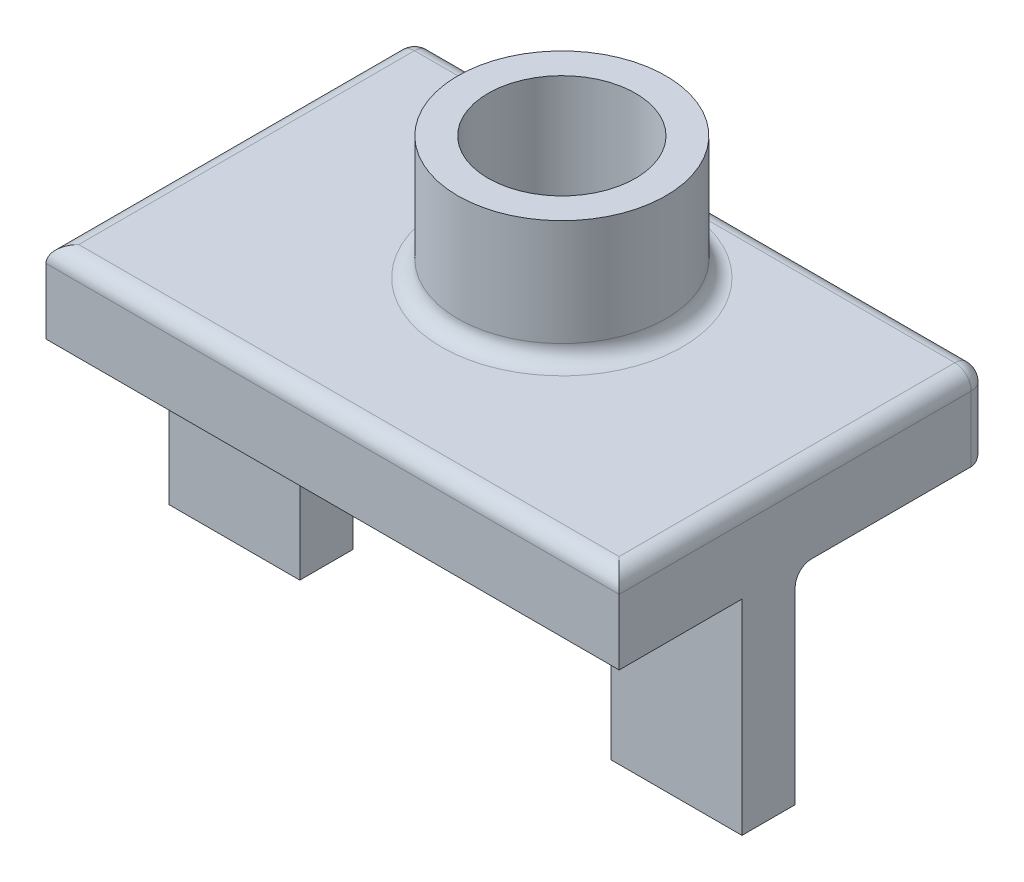
from build123d import *

# Parameters (mm, degrees)
SKETCH1_W           = 70
SKETCH1_H           = 45
BOSS_EXTRUDE1_DEPTH = 10
CUT_EXTRUDE1_DEPTH  = 5
FILLET1_R           = 2
SKETCH3_R           = 9
CUT_EXTRUDE3_DEPTH  = 25
BOSS_EXTRUDE2_START = 15
SKETCH5_R           = 12.7
SKETCH5_R_2         = 9
BOSS_EXTRUDE2_DEPTH = 15
FILLET2_R           = 2
SKETCH6_R           = 12.7
BOSS_EXTRUDE3_DEPTH = 8
FILLET3_R           = 2
SKETCH7_R           = 9
CUT_EXTRUDE4_DEPTH  = 5
SKETCH8_W           = 16
SKETCH8_H           = 6.5
BOSS_EXTRUDE4_DEPTH = 25
FILLET4_R           = 2


with BuildPart() as part:
    # Sketch1 → Boss-Extrude1 (new body)
    with BuildSketch(Plane(origin=(0, 0, 0), x_dir=(1, 0, 0), z_dir=(0, 1, 0))):
        with Locations((-1.479524439, -4.65323646)):
            Rectangle(SKETCH1_W, SKETCH1_H)
    extrude(amount=BOSS_EXTRUDE1_DEPTH)

    # Sketch2 → Cut-Extrude1 (cut)
    with BuildSketch(Plane.XZ):
        Polygon((28.520475561, 24.15323646), (17.520475561, 24.15323646), (17.520475561, 12.15323646), (28.520475561, 12.15323646), (28.520475561, 21.15323646), (32.520475561, 21.15323646), (32.520475561, 24.15323646), align=None)
        Polygon((-31.479524439, 21.15323646), (-35.479524439, 21.15323646), (-35.479524439, 24.15323646), (-31.479524439, 24.15323646), (-20.479524439, 24.15323646), (-20.479524439, 12.15323646), (-31.479524439, 12.15323646), align=None)
    extrude(amount=-CUT_EXTRUDE1_DEPTH, mode=Mode.SUBTRACT)

    # Fillet1
    fillet1_edges = [part.edges().sort_by_distance(p)[0] for p in [
        (33.520475561, 10, 4.65323646),
        (-1.479524439, 10, -17.84676354),
        (-36.479524439, 10, 4.65323646),
        (-1.479524439, 0, -17.84676354),
        (-36.479524439, 5, -17.84676354),
        (33.520475561, 5, -17.84676354),
        (-1.479524439, 10, 27.15323646),
    ]]
    fillet(fillet1_edges, radius=FILLET1_R)

    # Sketch3 → Cut-Extrude3 (cut)
    with BuildSketch(Plane(origin=(0, 10, 0), x_dir=(1, 0, 0), z_dir=(0, 1, 0))):
        with Locations(Location((-1.479524439, 0.84676354, 0), (0, 0, 270))):
            Circle(SKETCH3_R)
    extrude(amount=-CUT_EXTRUDE3_DEPTH, mode=Mode.SUBTRACT)

    # Sketch5 → Boss-Extrude2 (add)
    with BuildSketch(Plane(origin=(0, 10, 0), x_dir=(1, 0, 0), z_dir=(0, 1, 0)).offset(BOSS_EXTRUDE2_START)):
        with Locations(Location((-1.479524439, 0.84676354, 0), (0, 0, 270))):
            Circle(SKETCH5_R)
        with Locations(Location((-1.479524439, 0.84676354, 0), (0, 0, 270))):
            Circle(SKETCH5_R_2, mode=Mode.SUBTRACT)
    extrude(amount=-BOSS_EXTRUDE2_DEPTH)

    # Fillet2
    fillet2_edges = [part.edges().sort_by_distance(p)[0] for p in [
        (-1.479524439, 10, -13.54676354),
    ]]
    fillet(fillet2_edges, radius=FILLET2_R)

    # Sketch6 → Boss-Extrude3 (add)
    with BuildSketch(Plane.XZ):
        with Locations(Location((-1.479524439, -0.84676354, 0), (0, 0, 90))):
            Circle(SKETCH6_R)
    extrude(amount=BOSS_EXTRUDE3_DEPTH)

    # Fillet3
    fillet3_edges = [part.edges().sort_by_distance(p)[0] for p in [
        (-1.479524439, 0, -13.54676354),
    ]]
    fillet(fillet3_edges, radius=FILLET3_R)

    # Sketch7 → Cut-Extrude4 (cut)
    with BuildSketch(Plane(origin=(0, 0, 0), x_dir=(1, 0, 0), z_dir=(0, 1, 0))):
        with Locations(Location((-1.479524439, 0.84676354, 0), (0, 0, 270))):
            Circle(SKETCH7_R)
    extrude(amount=-CUT_EXTRUDE4_DEPTH, mode=Mode.SUBTRACT)

    # Sketch8 → Boss-Extrude4 (add)
    with BuildSketch(Plane.XZ):
        with Locations((-28.479524439, 8.90323646)):
            Rectangle(SKETCH8_W, SKETCH8_H)
        with Locations((25.520475561, 8.90323646)):
            Rectangle(SKETCH8_W, SKETCH8_H)
    extrude(amount=BOSS_EXTRUDE4_DEPTH)

    # Fillet4
    fillet4_edges = [part.edges().sort_by_distance(p)[0] for p in [
        (-20.479524439, 0, 8.90323646),
        (-28.479524439, 0, 5.65323646),
        (17.520475561, 0, 8.90323646),
        (25.520475561, 0, 5.65323646),
    ]]
    fillet(fillet4_edges, radius=FILLET4_R)


solid = part.part
